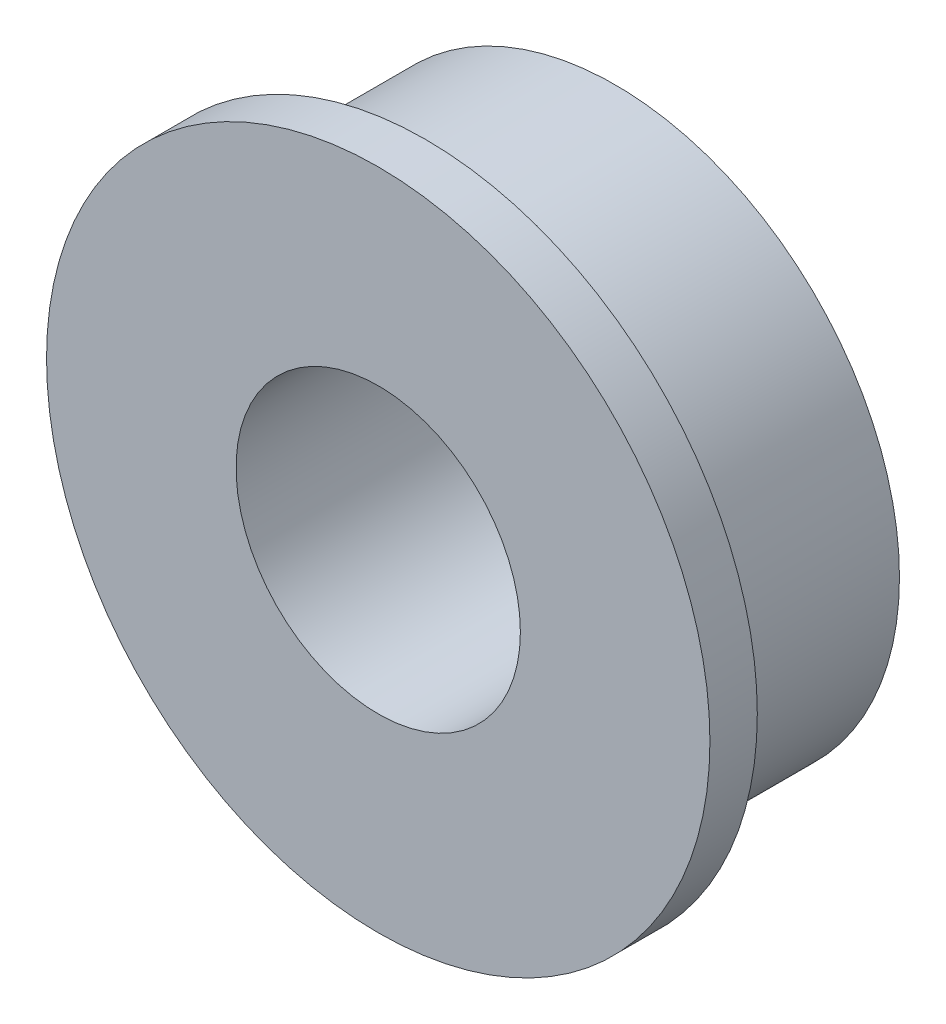
from build123d import *

# Parameters (mm, degrees)
SKETCH_1_R      = 3
SKETCH_1_R_2    = 1.5
EXTRUDE_1_DEPTH = 2
SKETCH_2_R      = 3.5
SKETCH_2_R_2    = 1.5
EXTRUDE_3_DEPTH = 0.5


with BuildPart() as part:
    # 草图1 → 凸台-拉伸1 (new body)
    with BuildSketch(Plane.XY):
        Circle(SKETCH_1_R)
        Circle(SKETCH_1_R_2, mode=Mode.SUBTRACT)
    extrude(amount=EXTRUDE_1_DEPTH)

    # 草图2 → 凸台-拉伸3 (add)
    with BuildSketch(Plane.XY.offset(2)):
        Circle(SKETCH_2_R)
        Circle(SKETCH_2_R_2, mode=Mode.SUBTRACT)
    extrude(amount=EXTRUDE_3_DEPTH)


solid = part.part
